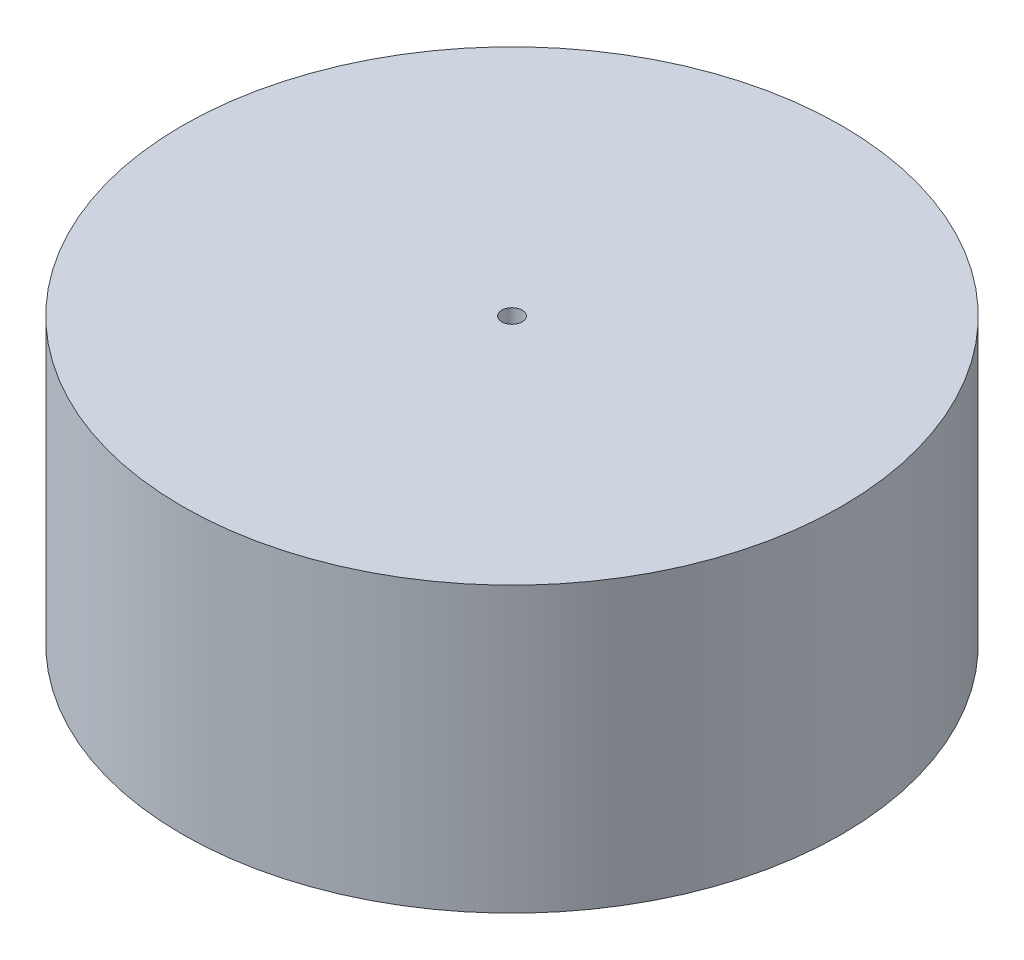
from build123d import *

# Parameters (mm, degrees)
SKETCH1_R           = 32.5
SKETCH1_R_2         = 1
BOSS_EXTRUDE1_DEPTH = 3
BOSS_EXTRUDE2_START = 25
SKETCH3_R           = 32.5
SKETCH3_R_2         = 30.5
BOSS_EXTRUDE2_DEPTH = 25
BOSS_EXTRUDE3_DEPTH = 2


with BuildPart() as part:
    # Sketch1 → Boss-Extrude1 (new body)
    with BuildSketch(Plane(origin=(0, 0, 0), x_dir=(1, 0, 0), z_dir=(0, 1, 0))):
        with Locations(Location((0, 0, 0), (0, 0, 270))):
            Circle(SKETCH1_R)
        with Locations(Location((0, 0, 0), (0, 0, 270))):
            Circle(SKETCH1_R_2, mode=Mode.SUBTRACT)
    extrude(amount=BOSS_EXTRUDE1_DEPTH)

    # Sketch3 → Boss-Extrude2 (add)
    with BuildSketch(Plane.XZ.offset(BOSS_EXTRUDE2_START)):
        with Locations(Location((0, 0, 0), (0, 0, 270))):
            Circle(SKETCH3_R)
        with Locations(Location((0, 0, 0), (0, 0, 270))):
            Circle(SKETCH3_R_2, mode=Mode.SUBTRACT)
    extrude(amount=-BOSS_EXTRUDE2_DEPTH)

    # Sketch7 → Boss-Extrude3 (add)
    with BuildSketch(Plane.XZ.offset(25)):
        with BuildLine():
            ThreePointArc((4.775324886, 27.082213208), (0, -27.5), (-4.775324886, 27.082213208))
            Line((-4.775324886, 27.082213208), (-5.296269419, 30.036636467))
            ThreePointArc((-5.296269419, 30.036636467), (-19.605022095, -23.364355515), (30.5, 0))
            ThreePointArc((30.5, 0), (23.364355515, 19.605022095), (5.296269419, 30.036636467))
            Line((5.296269419, 30.036636467), (4.775324886, 27.082213208))
        make_face()
    extrude(amount=-BOSS_EXTRUDE3_DEPTH)


solid = part.part
